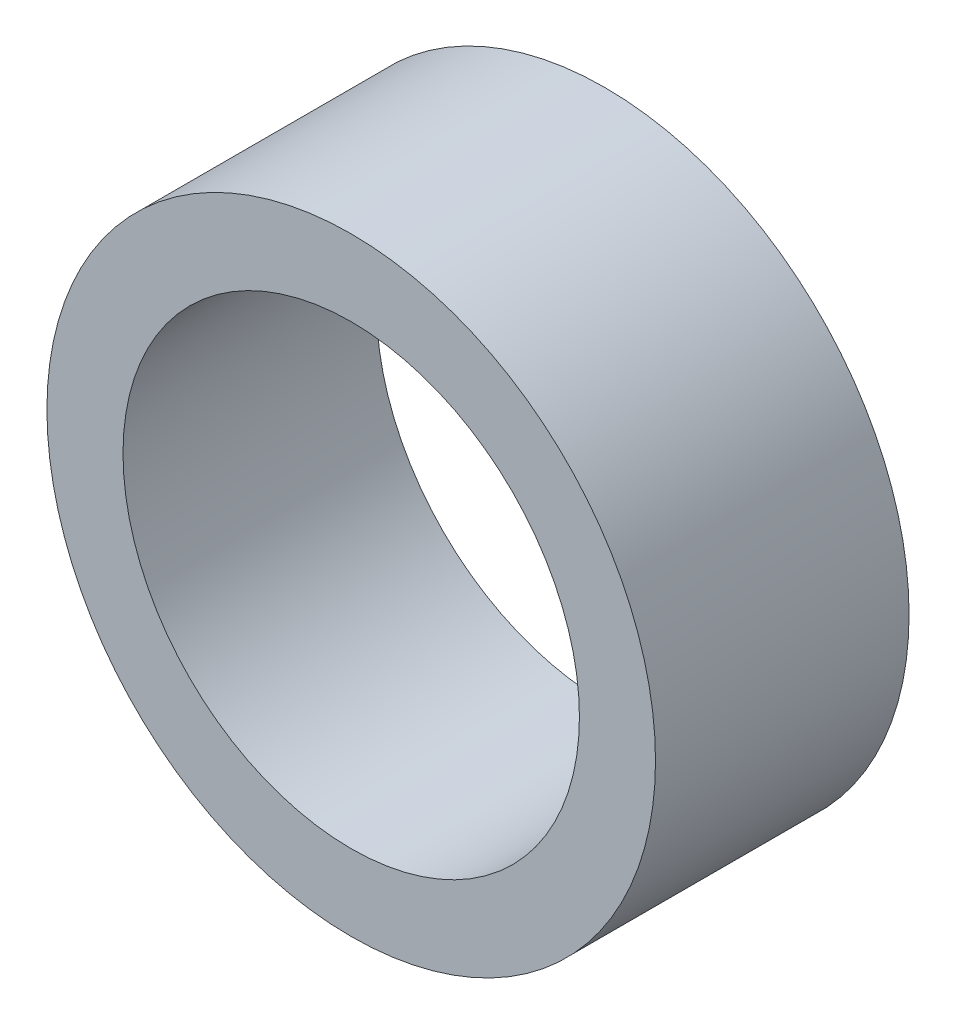
from build123d import *

# Parameters (mm, degrees)
ESQUISSE1_R             = 6
BOSS_EXTRU_1_DEPTH      = 5
ESQUISSE2_R             = 4.5
ENL_V_MAT_EXTRU_1_DEPTH = 10.848857802


with BuildPart() as part:
    # Esquisse1 → Boss.-Extru.1 (new body)
    with BuildSketch(Plane.XY):
        Circle(ESQUISSE1_R)
    extrude(amount=BOSS_EXTRU_1_DEPTH)

    # Esquisse2 → Enlèv. mat.-Extru.1 (cut, through all)
    with BuildSketch(Plane.XY.offset(5)):
        Circle(ESQUISSE2_R)
    extrude(amount=-ENL_V_MAT_EXTRU_1_DEPTH, mode=Mode.SUBTRACT)


solid = part.part
